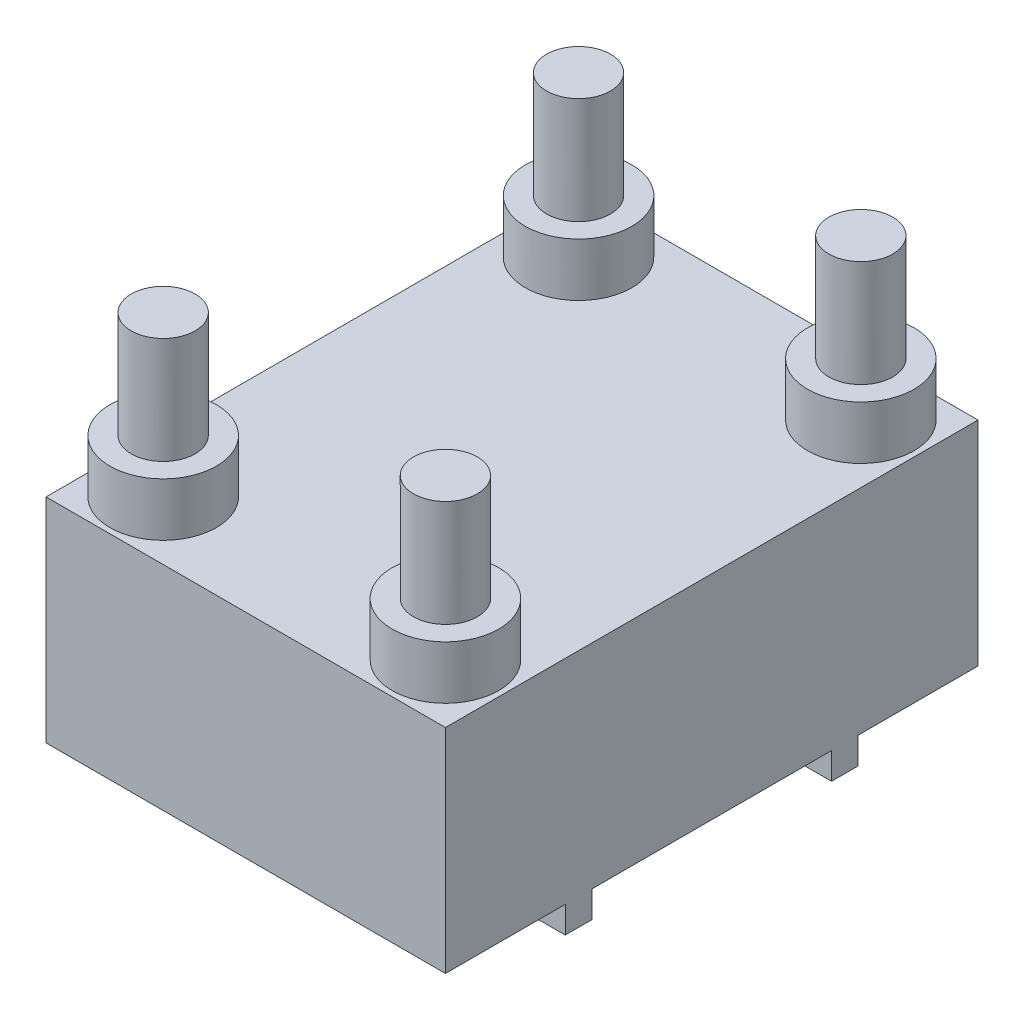
from build123d import *

# Parameters (mm, degrees)
CROQUIS2_W              = 75
CROQUIS2_H              = 100
SALIENTE_EXTRUIR1_DEPTH = 40
CROQUIS3_W              = 75
CROQUIS3_H              = 5
SALIENTE_EXTRUIR2_DEPTH = 5
CROQUIS4_R              = 10
CROQUIS4_R_2            = 6
SALIENTE_EXTRUIR7_DEPTH = 10
CROQUIS9_R              = 6
SALIENTE_EXTRUIR8_DEPTH = 30


with BuildPart() as part:
    # Croquis2 → Saliente-Extruir1 (new body)
    with BuildSketch(Plane(origin=(0, 0, 0), x_dir=(1, 0, 0), z_dir=(0, 1, 0))):
        Rectangle(CROQUIS2_W, CROQUIS2_H)
    extrude(amount=SALIENTE_EXTRUIR1_DEPTH)

    # Croquis3 → Saliente-Extruir2 (add)
    with BuildSketch(Plane.XZ):
        with Locations((0, 25)):
            Rectangle(CROQUIS3_W, CROQUIS3_H)
        with Locations((0, -25)):
            Rectangle(CROQUIS3_W, CROQUIS3_H)
    extrude(amount=SALIENTE_EXTRUIR2_DEPTH)

    # Croquis4 → Saliente-Extruir7 (add)
    # profile 1 of 4: a face of its own
    with BuildSketch(Plane(origin=(0, 40, 0), x_dir=(1, 0, 0), z_dir=(0, 1, 0))):
        with Locations(Location((-26.5, 39, 0), (0, 0, 90))):
            Circle(CROQUIS4_R)
        with Locations(Location((-26.5, 39, 0), (0, 0, 270))):
            Circle(CROQUIS4_R_2, mode=Mode.SUBTRACT)
    # profile 2 of 4: a face of its own
    with BuildSketch(Plane(origin=(0, 40, 0), x_dir=(1, 0, 0), z_dir=(0, 1, 0))):
        with Locations(Location((26.5, 39, 0), (0, 0, 90))):
            Circle(CROQUIS4_R)
        with Locations(Location((26.5, 39, 0), (0, 0, 90))):
            Circle(CROQUIS4_R_2, mode=Mode.SUBTRACT)
    # profile 3 of 4: a face of its own
    with BuildSketch(Plane(origin=(0, 40, 0), x_dir=(1, 0, 0), z_dir=(0, 1, 0))):
        with Locations(Location((26.5, -39, 0), (0, 0, 90))):
            Circle(CROQUIS4_R)
        with Locations(Location((26.5, -39, 0), (0, 0, 270))):
            Circle(CROQUIS4_R_2, mode=Mode.SUBTRACT)
    # profile 4 of 4: a face of its own
    with BuildSketch(Plane(origin=(0, 40, 0), x_dir=(1, 0, 0), z_dir=(0, 1, 0))):
        with Locations(Location((-26.5, -39, 0), (0, 0, 90))):
            Circle(CROQUIS4_R)
        with Locations(Location((-26.5, -39, 0), (0, 0, 90))):
            Circle(CROQUIS4_R_2, mode=Mode.SUBTRACT)
    extrude(amount=SALIENTE_EXTRUIR7_DEPTH)

    # Croquis9 → Saliente-Extruir8 (add)
    with BuildSketch(Plane(origin=(0, 40, 0), x_dir=(1, 0, 0), z_dir=(0, 1, 0))):
        with Locations(Location((-26.5, -39, 0), (0, 0, 90))):
            Circle(CROQUIS9_R)
        with Locations(Location((-26.5, 39, 0), (0, 0, 90))):
            Circle(CROQUIS9_R)
        with Locations(Location((26.5, -39, 0), (0, 0, 90))):
            Circle(CROQUIS9_R)
        with Locations(Location((26.5, 39, 0), (0, 0, 90))):
            Circle(CROQUIS9_R)
    extrude(amount=SALIENTE_EXTRUIR8_DEPTH)


solid = part.part
